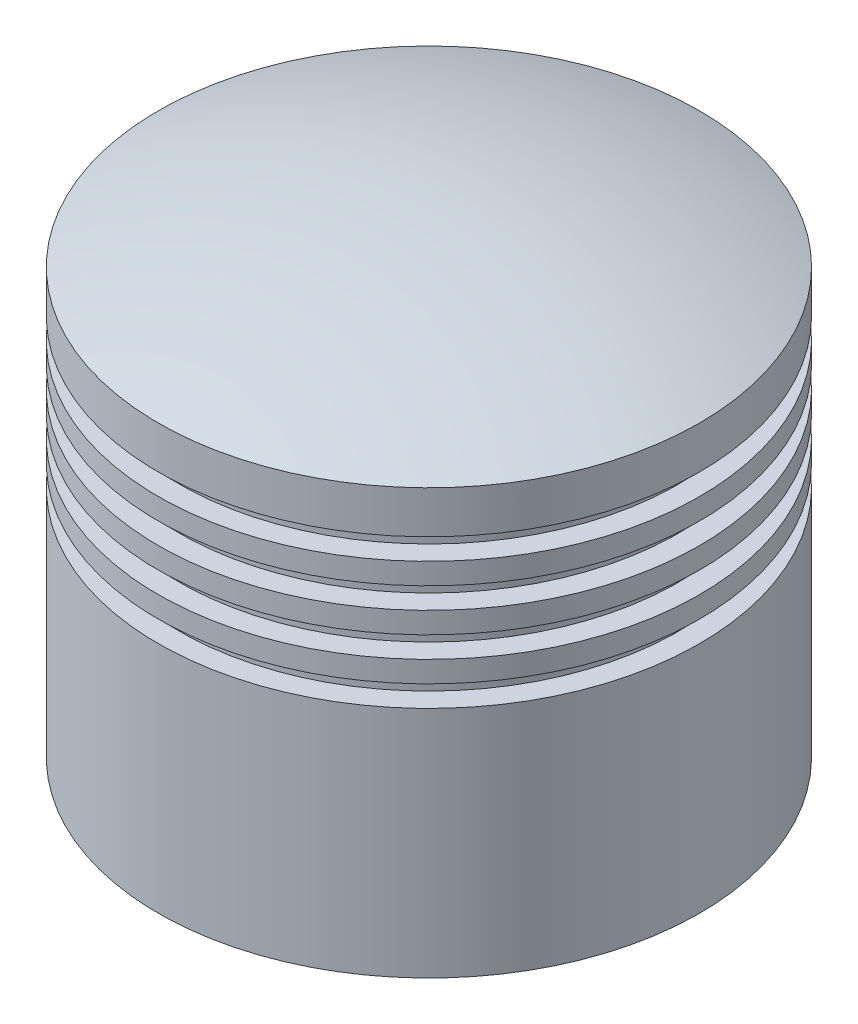
from build123d import *


with BuildPart() as part:
    # Sketch1 → Revolve1 (revolve)
    with BuildSketch(Plane.XY, mode=Mode.PRIVATE) as revolve1_sk:
        with BuildLine():
            Line((63.722275674, 0), (63.722275674, 55))
            Line((63.722275674, 55), (58.722275674, 55))
            Line((58.722275674, 55), (58.722275674, 60))
            Line((58.722275674, 60), (63.722275674, 60))
            Line((63.722275674, 60), (63.722275674, 65))
            Line((63.722275674, 65), (58.722275674, 65))
            Line((58.722275674, 65), (58.722275674, 70))
            Line((58.722275674, 70), (63.722275674, 70))
            Line((63.722275674, 70), (63.722275674, 75))
            Line((63.722275674, 75), (58.722275674, 75))
            Line((58.722275674, 75), (58.722275674, 80))
            Line((58.722275674, 80), (63.722275674, 80))
            Line((63.722275674, 80), (63.722275674, 85))
            Line((63.722275674, 85), (58.722275674, 85))
            Line((58.722275674, 85), (58.722275674, 90))
            Line((58.722275674, 90), (63.722275674, 90))
            Line((63.722275674, 90), (63.722275674, 100))
            ThreePointArc((63.722275674, 100), (32.458256966, 109.267160728), (0, 112.394569945))
            Line((0, 112.394569945), (0, 105.394569945))
            ThreePointArc((0, 105.394569945), (21.692969078, 103.944608919), (43, 99.620522001))
            Line((43, 99.620522001), (43, 30))
            Line((43, 30), (50, 30))
            Line((50, 30), (50, 0))
            Line((50, 0), (63.722275674, 0))
        make_face()
    revolve(revolve1_sk.sketch.rotate(Axis((0, 0, 0), (0, 1, 0)), 90), axis=Axis((0, 0, 0), (0, 1, 0)))


solid = part.part
